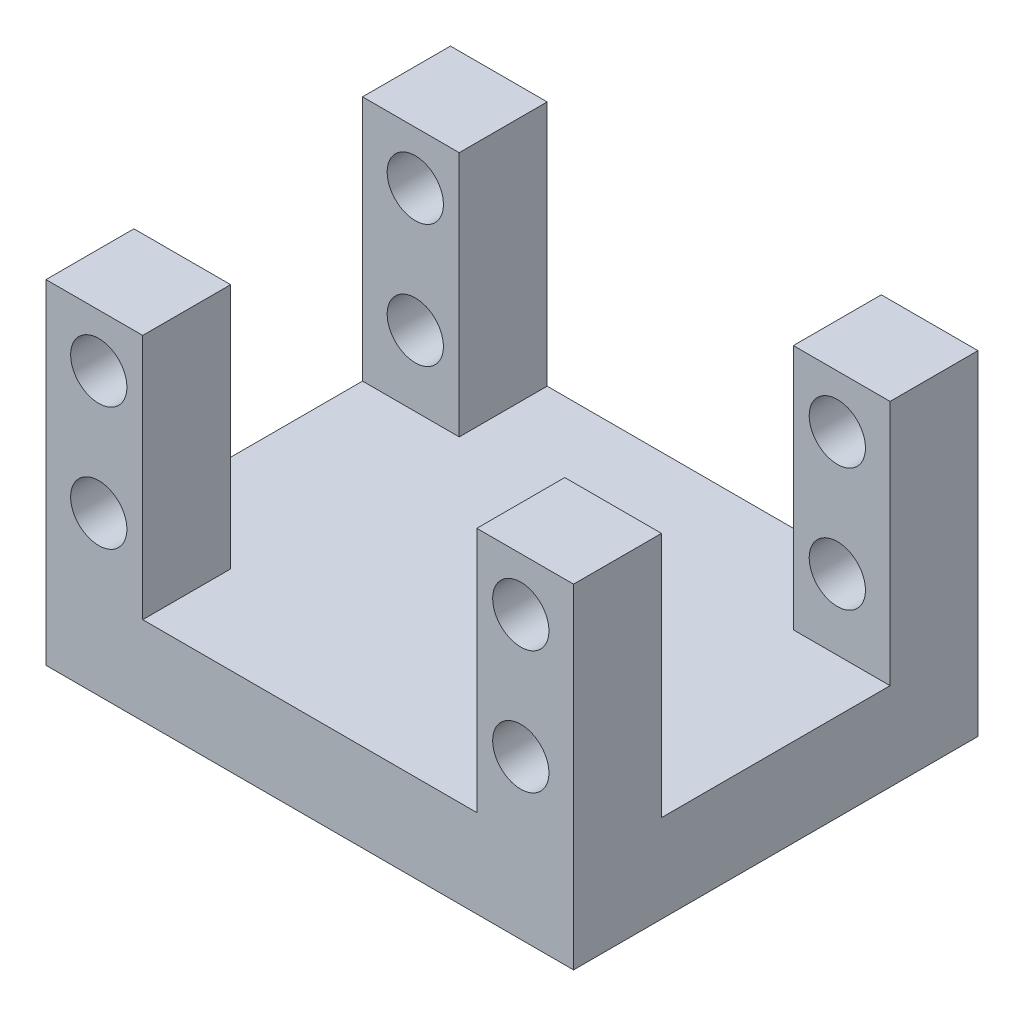
from build123d import *

# Parameters (mm, degrees)
EXTRUDE_1_DEPTH     = 23
HOLE_WIZARD_1_D     = 3.2
SKETCH_4_W          = 13
SKETCH_4_H          = 14
CUT_EXTRUDE_1_DEPTH = 39.977557645


with BuildPart() as part:
    # 草图1 → 凸台-拉伸1 (new body)
    with BuildSketch(Plane.XY):
        Polygon((-15, -9.5), (15, -9.5), (15, 9.5), (9.5, 9.5), (9.5, -4.5), (-9.5, -4.5), (-9.5, 9.5), (-15, 9.5), align=None)
    extrude(amount=EXTRUDE_1_DEPTH)

    # 孔1 (through all)
    with Locations(Plane(origin=(0, 0, 0), x_dir=(-1, 0, 0), z_dir=(0, 0, -1))):
        with Locations((12, 6.5), (12, -0.5), (-12, -0.5), (-12, 6.5)):
            Hole(HOLE_WIZARD_1_D / 2)

    # 草图4 → 切除-拉伸1 (cut, through all)
    with BuildSketch(Plane(origin=(15, 0, 0), x_dir=(0, 0, -1), z_dir=(1, 0, 0))):
        with Locations((-11.5, 2.5)):
            Rectangle(SKETCH_4_W, SKETCH_4_H)
    extrude(amount=-CUT_EXTRUDE_1_DEPTH, mode=Mode.SUBTRACT)


solid = part.part
